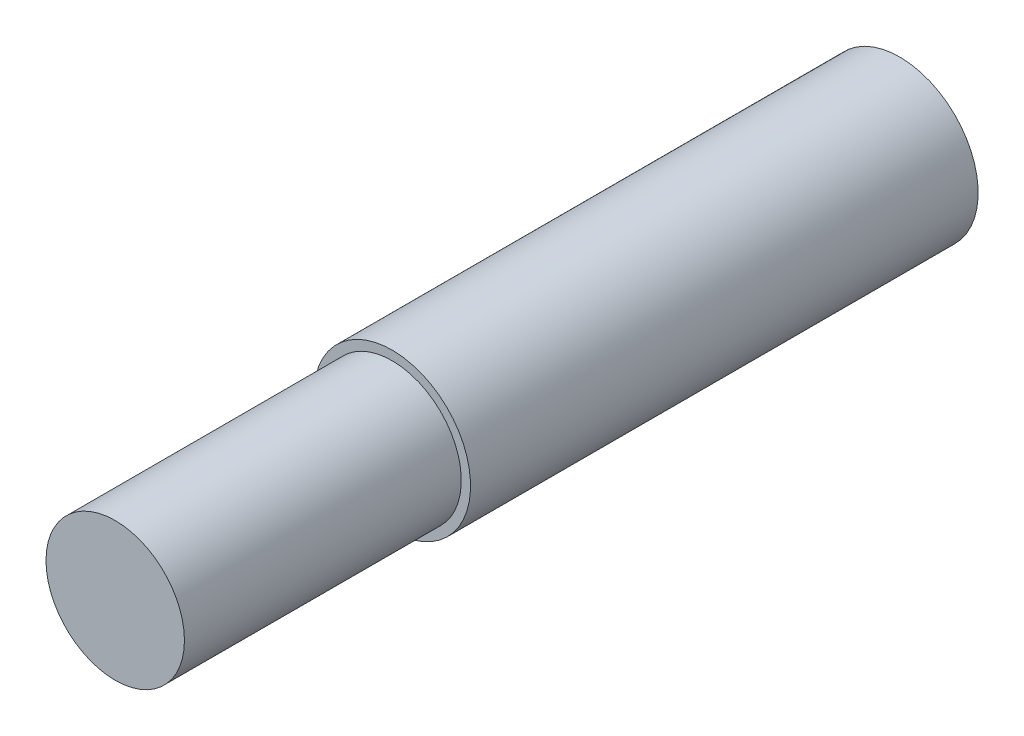
from build123d import *

# Parameters (mm, degrees)
SKETCH1_R           = 7.5
BOSS_EXTRUDE1_DEPTH = 30
SKETCH2_R           = 8.5
SKETCH2_R_2         = 6
BOSS_EXTRUDE2_DEPTH = 55
SKETCH3_R           = 6
BOSS_EXTRUDE3_DEPTH = 3


with BuildPart() as part:
    # Sketch1 → Boss-Extrude1 (new body)
    with BuildSketch(Plane.XY):
        Circle(SKETCH1_R)
    extrude(amount=BOSS_EXTRUDE1_DEPTH)

    # Sketch2 → Boss-Extrude2 (add)
    with BuildSketch(Plane(origin=(0, 0, 0), x_dir=(-1, 0, 0), z_dir=(0, 0, -1))):
        Circle(SKETCH2_R)
        Circle(SKETCH2_R_2, mode=Mode.SUBTRACT)
    extrude(amount=BOSS_EXTRUDE2_DEPTH)

    # Sketch3 → Boss-Extrude3 (add)
    with BuildSketch(Plane(origin=(0, 0, 0), x_dir=(-1, 0, 0), z_dir=(0, 0, -1))):
        Circle(SKETCH3_R)
    extrude(amount=BOSS_EXTRUDE3_DEPTH)


solid = part.part
